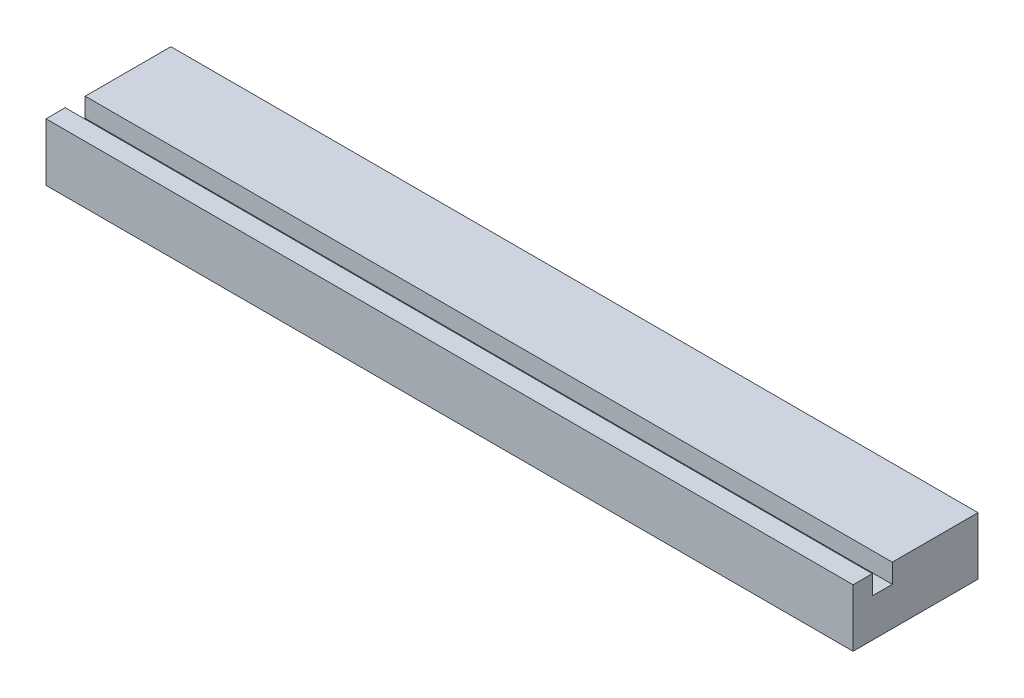
from build123d import *

# Parameters (mm, degrees)
SKETCH1_W           = 266.7
SKETCH1_H           = 19.05
BOSS_EXTRUDE1_DEPTH = 41.275
SKETCH2_W           = 266.7
SKETCH2_H           = 6.604
CUT_EXTRUDE1_DEPTH  = 6.35


with BuildPart() as part:
    # Sketch1 → Boss-Extrude1 (new body)
    with BuildSketch(Plane.XY):
        Rectangle(SKETCH1_W, SKETCH1_H)
    extrude(amount=BOSS_EXTRUDE1_DEPTH)

    # Sketch2 → Cut-Extrude1 (cut)
    with BuildSketch(Plane(origin=(0, 9.525, 0), x_dir=(1, 0, 0), z_dir=(0, 1, 0))):
        with Locations((0, -31.623)):
            Rectangle(SKETCH2_W, SKETCH2_H)
    extrude(amount=-CUT_EXTRUDE1_DEPTH, mode=Mode.SUBTRACT)


solid = part.part
